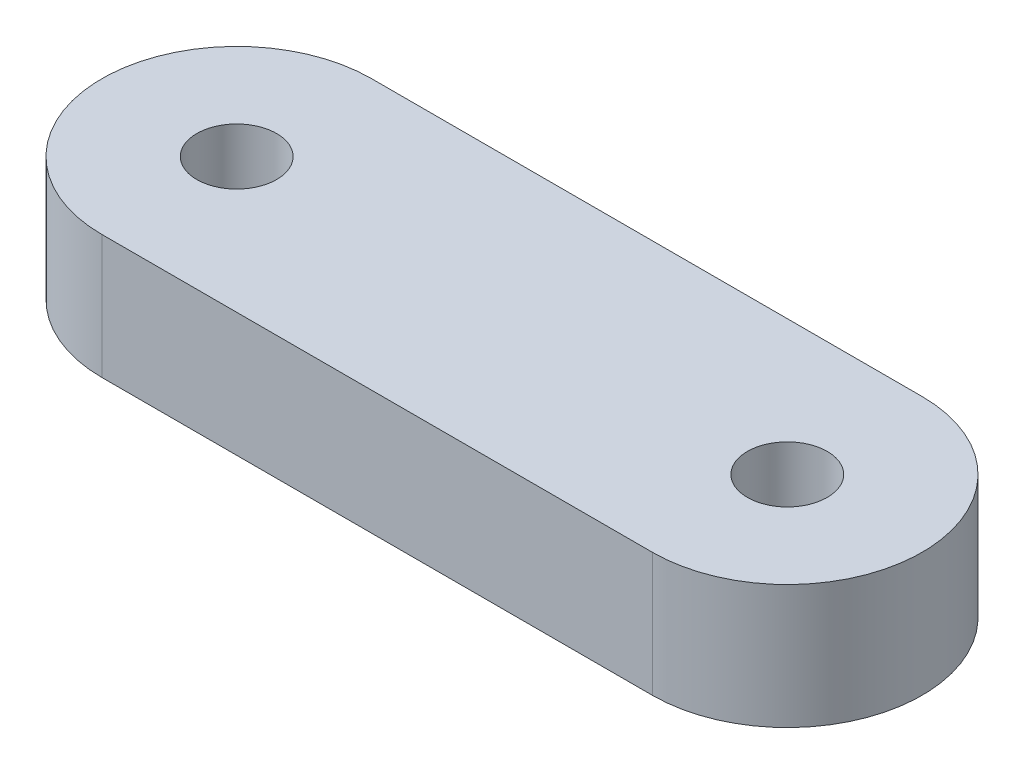
from build123d import *

# Parameters (mm, degrees)
SKETCH1_R           = 1.45
BOSS_EXTRUDE1_DEPTH = 4.5


with BuildPart() as part:
    # Sketch1 → Boss-Extrude1 (new body)
    with BuildSketch(Plane(origin=(0, 0, 0), x_dir=(1, 0, 0), z_dir=(0, 1, 0))):
        with BuildLine():
            Line((-10.000000241, 4.9), (10.000000241, 4.9))
            ThreePointArc((10.000000241, 4.9), (14.9, 0), (10.000000241, -4.9))
            Line((10.000000241, -4.9), (-10.000000241, -4.9))
            ThreePointArc((-10.000000241, -4.9), (-14.9, 0), (-10.000000241, 4.9))
        make_face()
        with Locations(Location((-10, 0, 0), (0, 0, 270))):
            Circle(SKETCH1_R, mode=Mode.SUBTRACT)
        with Locations(Location((10, 0, 0), (0, 0, 90))):
            Circle(SKETCH1_R, mode=Mode.SUBTRACT)
    extrude(amount=BOSS_EXTRUDE1_DEPTH)


solid = part.part
